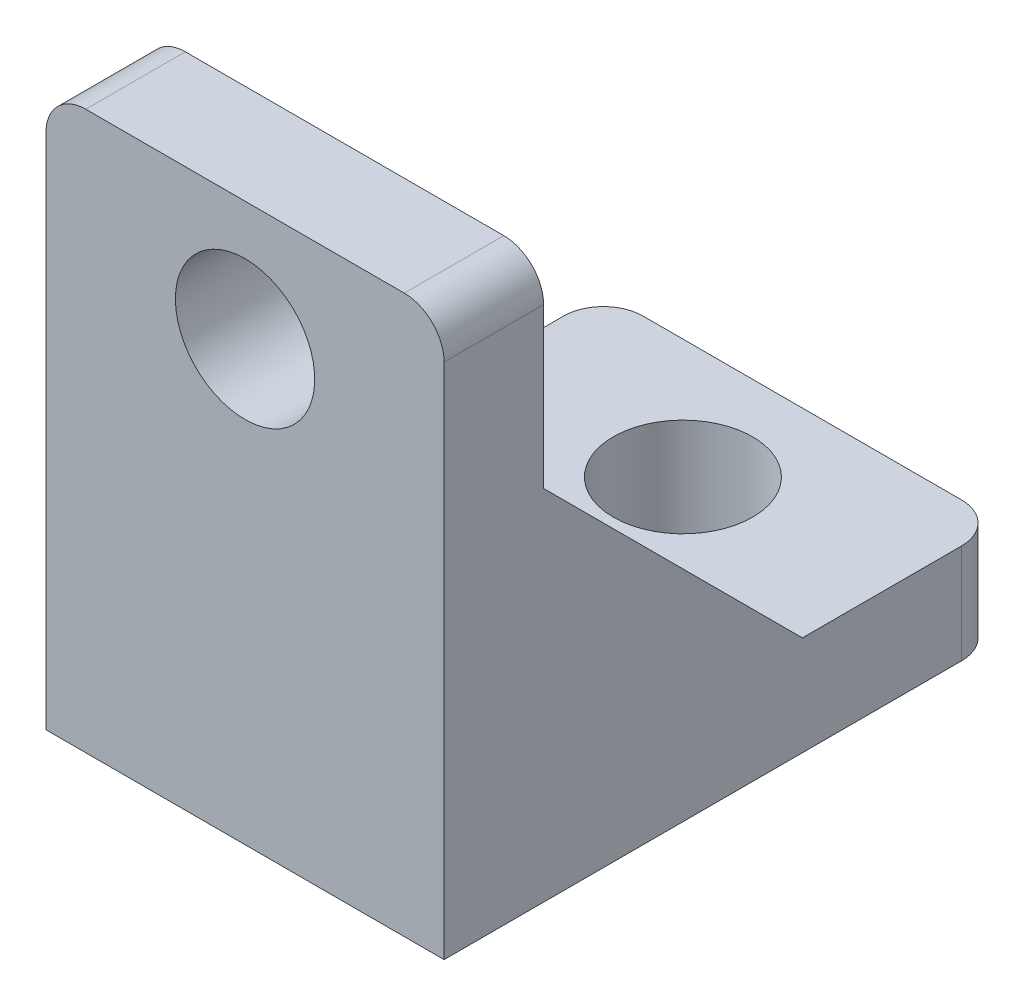
from build123d import *

# Parameters (mm, degrees)
BOSS_EXTRUDE3_DEPTH = 20
BOSS_EXTRUDE4_DEPTH = 3
BOSS_EXTRUDE5_DEPTH = 3
FILLET5_R           = 2
CUT_EXTRUDE1_REACH  = 43.388
SKETCH6_R           = 3.5
CUT_EXTRUDE2_REACH  = 43.388
SKETCH7_R           = 3.5


with BuildPart() as part:
    # Sketch3 → Boss-Extrude3 (new body)
    with BuildSketch(Plane(origin=(0, 0, 0), x_dir=(0, 0, -1), z_dir=(1, 0, 0))):
        Polygon((0, 0), (0, 28), (5, 28), (5, 5), (28, 5), (28, 0), align=None)
    extrude(amount=BOSS_EXTRUDE3_DEPTH)

    # Sketch4 → Boss-Extrude4 (add)
    with BuildSketch(Plane(origin=(20, 0, 0), x_dir=(0, 0, -1), z_dir=(1, 0, 0))):
        Polygon((5, 18), (5, 5), (18, 5), align=None)
    extrude(amount=-BOSS_EXTRUDE4_DEPTH)

    # Sketch5 → Boss-Extrude5 (add)
    with BuildSketch(Plane.ZY):
        Polygon((-5, 18), (-5, 5), (-18, 5), align=None)
    extrude(amount=-BOSS_EXTRUDE5_DEPTH)

    # Fillet5
    fillet5_edges = [part.edges().sort_by_distance(p)[0] for p in [
        (20, 28, -2.5),
        (10, 5, -5),
        (0, 28, -2.5),
        (0, 2.5, -28),
        (20, 2.5, -28),
    ]]
    fillet(fillet5_edges, radius=FILLET5_R)

    # Sketch6 → Cut-Extrude1 (cut, up to next)
    with BuildSketch(Plane(origin=(0, 0, -5), x_dir=(-1, 0, 0), z_dir=(0, 0, -1)), mode=Mode.PRIVATE) as cut_extrude1_sk1:
        with Locations(Location((-10, 22, 0), (0, 0, 90))):
            Circle(SKETCH6_R)
    cut_extrude1_tool1 = extrude(cut_extrude1_sk1.sketch, amount=-CUT_EXTRUDE1_REACH, mode=Mode.PRIVATE) & part.part
    add(cut_extrude1_tool1.solids().sort_by_distance((10, 22, -5))[0], mode=Mode.SUBTRACT)

    # Sketch7 → Cut-Extrude2 (cut, up to next)
    with BuildSketch(Plane(origin=(0, 5, 0), x_dir=(1, 0, 0), z_dir=(0, 1, 0)), mode=Mode.PRIVATE) as cut_extrude2_sk1:
        with Locations(Location((10, 22, 0), (0, 0, 270))):
            Circle(SKETCH7_R)
    cut_extrude2_tool1 = extrude(cut_extrude2_sk1.sketch, amount=-CUT_EXTRUDE2_REACH, mode=Mode.PRIVATE) & part.part
    add(cut_extrude2_tool1.solids().sort_by_distance((10, 5, -22))[0], mode=Mode.SUBTRACT)


solid = part.part
